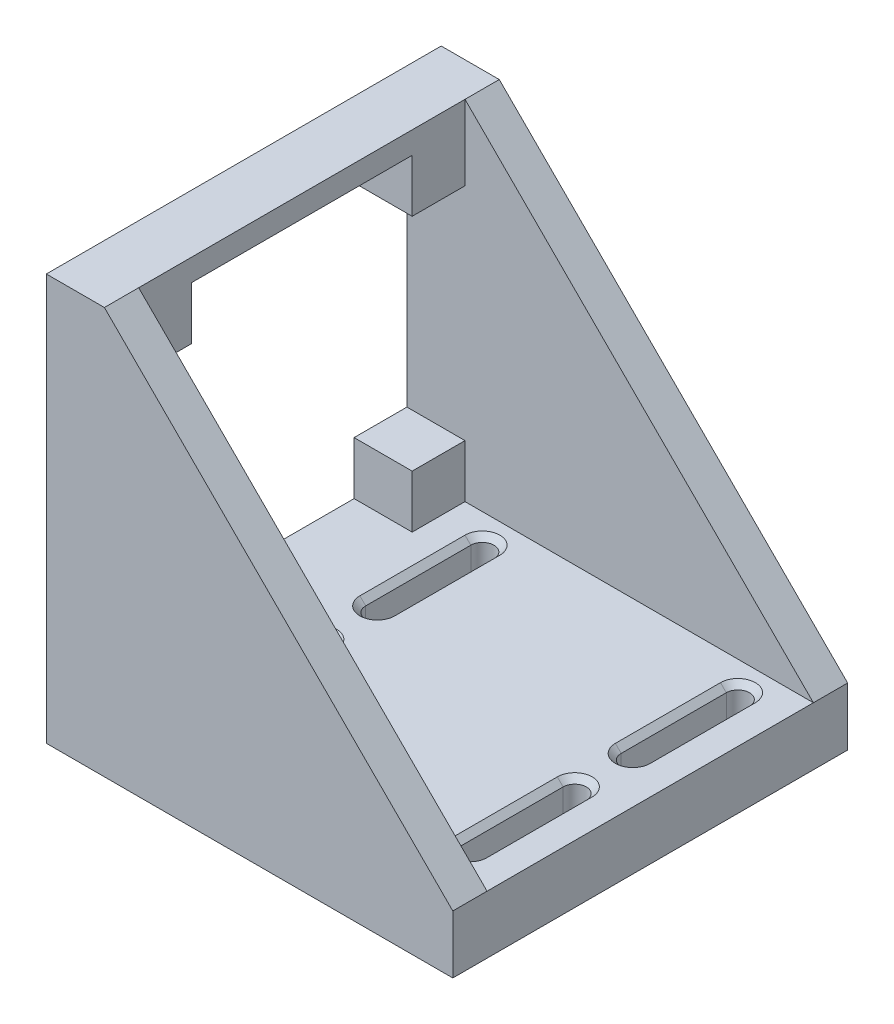
from build123d import *

# Parameters (mm, degrees)
BOSS_EXTRUDE1_DEPTH = 34
CUT_EXTRUDE1_DEPTH  = 28.1
CUT_EXTRUDE2_DEPTH  = 99.264947972
CHAMFER1_SIZE       = 1
CUT_EXTRUDE3_DEPTH  = 79.788387469


with BuildPart() as part:
    # Sketch2 → Boss-Extrude1 (new, symmetric)
    with BuildSketch(Plane.XY):
        Polygon((0, 31.9), (0, -38.1), (70, -38.1), (70, -28.1), (10, 31.9), align=None)
    extrude(amount=BOSS_EXTRUDE1_DEPTH, both=True)

    # Sketch4 → Cut-Extrude1 (cut, symmetric)
    with BuildSketch(Plane.XY):
        Polygon((10, 31.9), (70, -28.1), (10, -28.1), align=None)
    extrude(amount=CUT_EXTRUDE1_DEPTH, both=True, mode=Mode.SUBTRACT)

    # Sketch5 → Cut-Extrude2 (cut, through all)
    with BuildSketch(Plane(origin=(0, -28.1, 0), x_dir=(1, 0, 0), z_dir=(0, 1, 0))):
        with BuildLine():
            Line((20, 23.1), (20, 5))
            ThreePointArc((20, 5), (18, 3), (16, 5))
            Line((16, 5), (16, 23.1))
            ThreePointArc((16, 23.1), (18, 25.1), (20, 23.1))
        make_face()
        with BuildLine():
            Line((64, 23.1), (64, 5))
            ThreePointArc((64, 5), (62, 3), (60, 5))
            Line((60, 5), (60, 23.1))
            ThreePointArc((60, 23.1), (62, 25.1), (64, 23.1))
        make_face()
        with BuildLine():
            Line((64, -23.1), (64, -5))
            ThreePointArc((64, -5), (62, -3), (60, -5))
            Line((60, -5), (60, -23.1))
            ThreePointArc((60, -23.1), (62, -25.1), (64, -23.1))
        make_face()
        with BuildLine():
            Line((20, -23.1), (20, -5))
            ThreePointArc((20, -5), (18, -3), (16, -5))
            Line((16, -5), (16, -23.1))
            ThreePointArc((16, -23.1), (18, -25.1), (20, -23.1))
        make_face()
    extrude(amount=-CUT_EXTRUDE2_DEPTH, mode=Mode.SUBTRACT)

    # Chamfer1
    chamfer1_edges = [part.edges().sort_by_distance(p)[0] for p in [
        (18, -28.1, 25.1),
        (20, -28.1, 14.05),
        (18, -28.1, 3),
        (16, -28.1, 14.05),
        (62, -28.1, 25.1),
        (64, -28.1, 14.05),
        (62, -28.1, 3),
        (60, -28.1, 14.05),
        (62, -28.1, -25.1),
        (60, -28.1, -14.05),
        (62, -28.1, -3),
        (64, -28.1, -14.05),
        (18, -28.1, -25.1),
        (16, -28.1, -14.05),
        (18, -28.1, -3),
        (20, -28.1, -14.05),
    ]]
    chamfer(chamfer1_edges, length=CHAMFER1_SIZE)

    # Sketch6 → Cut-Extrude3 (cut, through all)
    with BuildSketch(Plane(origin=(10, 0, 0), x_dir=(0, 0, -1), z_dir=(1, 0, 0))):
        Polygon((-28.1, 19), (-28.1, -19), (-19, -19), (-19, -28.1), (19, -28.1), (19, -19), (28.1, -19), (28.1, 19), (19, 19), (19, 28.1), (-19, 28.1), (-19, 19), align=None)
    extrude(amount=-CUT_EXTRUDE3_DEPTH, mode=Mode.SUBTRACT)


solid = part.part
